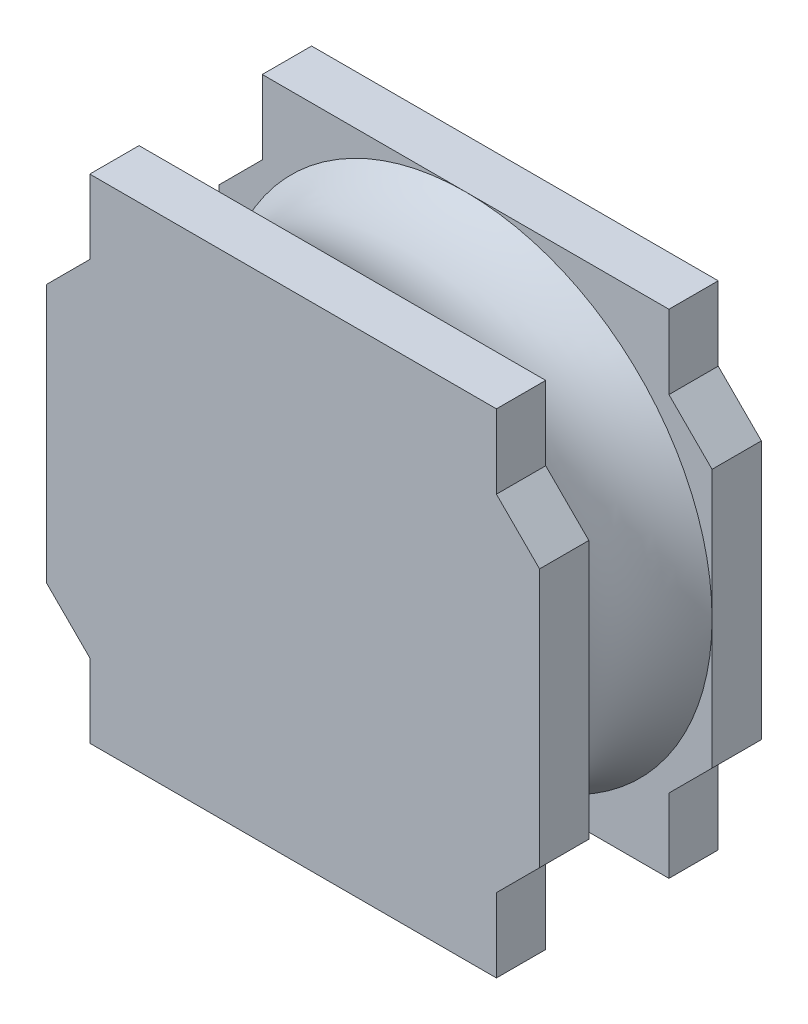
from build123d import *

# Parameters (mm, degrees)
BOSS_EXTRUDE1_DEPTH = 1.8


with BuildPart() as part:
    # Sketch1 → Boss-Extrude1 (new body)
    with BuildSketch(Plane.XY):
        Polygon((-1.65, 2), (1.65, 2), (1.65, 1.4), (2, 1.05), (2, -1.05), (1.65, -1.4), (1.65, -2), (-1.65, -2), (-1.65, -1.4), (-2, -1.05), (-2, 1.05), (-1.65, 1.4), align=None)
    extrude(amount=BOSS_EXTRUDE1_DEPTH)

    # Sketch2 → Cut-Revolve1 (revolve, cut)
    with BuildSketch(Plane(origin=(0, 0, 0), x_dir=(1, 0, 0), z_dir=(0, 1, 0))):
        with BuildLine():
            Line((2, -0.4), (3.5, -0.4))
            Line((3.5, -0.4), (3.5, -1.4))
            Line((3.5, -1.4), (2, -1.4))
            add(Edge.make_bspline(
                [(2, -0.4), (1.7, -0.9), (2, -1.4)],
                knots=[0, 0, 0, 1, 1, 1], degree=2))
        make_face()
    revolve(axis=Axis((0, 0, 0.4), (0, 0, 1)), mode=Mode.SUBTRACT)


solid = part.part
